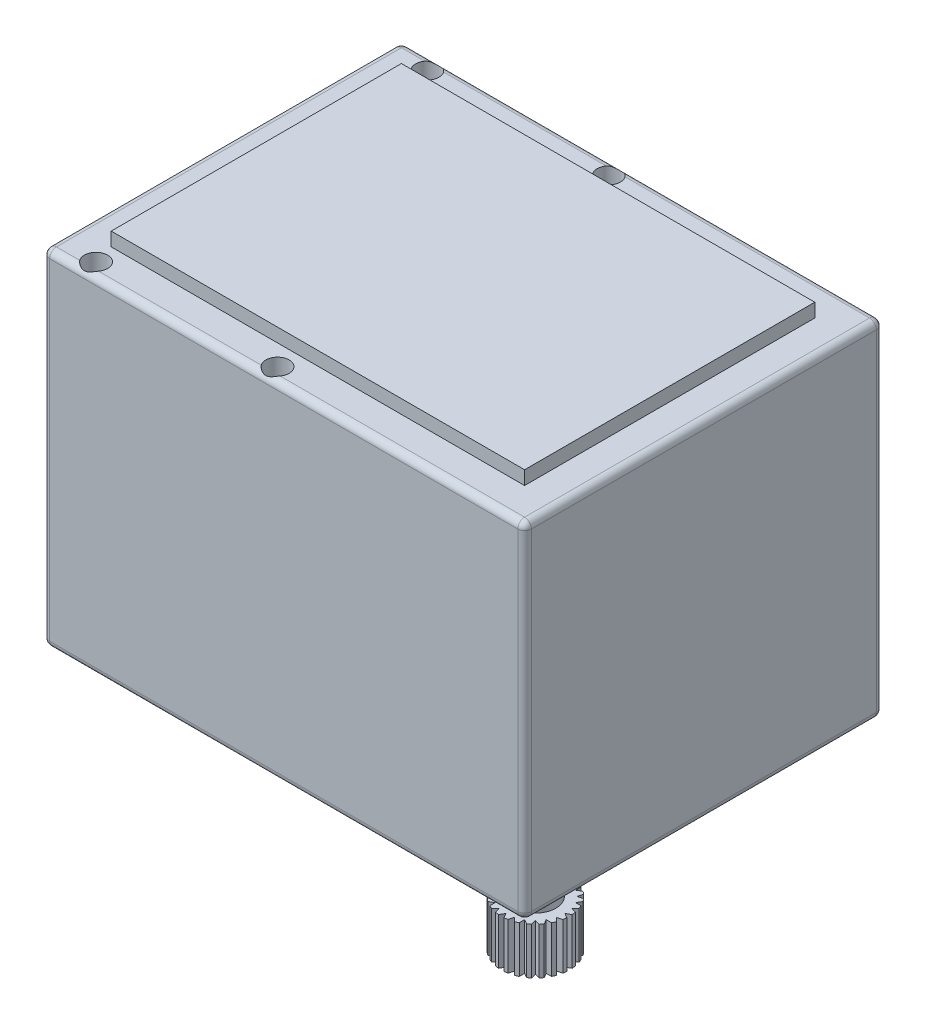
from build123d import *

# Parameters (mm, degrees)
EXTRUDE_START        = -6.25
SKETCH_1_W           = 35.2
SKETCH_1_H           = 25.2
EXTRUDE_1_DEPTH      = 13.1
EXTRUDE_5_DEPTH      = 4.4
SKETCH_16_R          = 1.3
CUT_EXTRUDE_7_DEPTH  = 5.5
FILLET_2_R           = 0.5
SKETCH_17_W          = 30.2
SKETCH_17_H          = 21.2
EXTRUDE_6_DEPTH      = 1
SKETCH_18_W          = 30.2
SKETCH_18_H          = 21.2
EXTRUDE_7_DEPTH      = 1
SKETCH_19_R          = 0.85
CUT_EXTRUDE_8_DEPTH  = 5
CUT_EXTRUDE_START    = -5
SKETCH_21_R          = 0.85
CUT_EXTRUDE_9_DEPTH  = 5
MOVE_FACE_1_BY       = 10
SKETCH_22_R          = 3.658774852
SKETCH_22_R_2        = 1.5
CUT_EXTRUDE_10_DEPTH = 10
EXTRUDE_START_2      = 10
SKETCH_23_R          = 1.3
EXTRUDE_8_DEPTH      = 10


with BuildPart() as part:
    # 草图1 → 凸台-拉伸1 (new, symmetric)
    with BuildSketch(Plane.XY.offset(6.25).offset(EXTRUDE_START)):
        with Locations((0, -0.411180124)):
            Rectangle(SKETCH_1_W, SKETCH_1_H)
    extrude(amount=EXTRUDE_1_DEPTH, both=True)

    # 草图15 → 凸台-拉伸5 (add)
    with BuildSketch(Plane.XZ.offset(13.011180124)):
        with BuildLine():
            Line((3.874456691, -2.060639983), (4.213205081, -1.865063509))
            Line((4.213205081, -1.865063509), (4.213205081, -2.256216457))
            ThreePointArc((4.213205081, -2.256216457), (4.333291419, -2.309698831), (4.456023033, -2.356794946))
            Line((4.456023033, -2.356794946), (4.732609934, -2.080208044))
            Line((4.732609934, -2.080208044), (4.833847767, -2.458032779))
            ThreePointArc((4.833847767, -2.458032779), (4.963684519, -2.478612153), (5.094423526, -2.492338228))
            Line((5.094423526, -2.492338228), (5.29, -2.153589838))
            Line((5.29, -2.153589838), (5.485576474, -2.492338228))
            ThreePointArc((5.485576474, -2.492338228), (5.616315481, -2.478612153), (5.746152233, -2.458032779))
            Line((5.746152233, -2.458032779), (5.847390066, -2.080208044))
            Line((5.847390066, -2.080208044), (6.123976967, -2.356794946))
            ThreePointArc((6.123976967, -2.356794946), (6.246708581, -2.309698831), (6.366794919, -2.256216457))
            Line((6.366794919, -2.256216457), (6.366794919, -1.865063509))
            Line((6.366794919, -1.865063509), (6.705543309, -2.060639983))
            ThreePointArc((6.705543309, -2.060639983), (6.811903573, -1.983383351), (6.914055811, -1.900642713))
            Line((6.914055811, -1.900642713), (6.812817979, -1.522817979))
            Line((6.812817979, -1.522817979), (7.190642713, -1.624055811))
            ThreePointArc((7.190642713, -1.624055811), (7.273383351, -1.521903573), (7.350639983, -1.415543309))
            Line((7.350639983, -1.415543309), (7.155063509, -1.076794919))
            Line((7.155063509, -1.076794919), (7.546216457, -1.076794919))
            ThreePointArc((7.546216457, -1.076794919), (7.599698831, -0.956708581), (7.646794946, -0.833976967))
            Line((7.646794946, -0.833976967), (7.370208044, -0.557390066))
            Line((7.370208044, -0.557390066), (7.748032779, -0.456152233))
            ThreePointArc((7.748032779, -0.456152233), (7.768612153, -0.326315481), (7.782338228, -0.195576474))
            Line((7.782338228, -0.195576474), (7.443589838, 0))
            Line((7.443589838, 0), (7.782338228, 0.195576474))
            ThreePointArc((7.782338228, 0.195576474), (7.768612153, 0.326315481), (7.748032779, 0.456152233))
            Line((7.748032779, 0.456152233), (7.370208044, 0.557390066))
            Line((7.370208044, 0.557390066), (7.646794946, 0.833976967))
            ThreePointArc((7.646794946, 0.833976967), (7.599698831, 0.956708581), (7.546216457, 1.076794919))
            Line((7.546216457, 1.076794919), (7.155063509, 1.076794919))
            Line((7.155063509, 1.076794919), (7.350639983, 1.415543309))
            ThreePointArc((7.350639983, 1.415543309), (7.273383351, 1.521903573), (7.190642713, 1.624055811))
            Line((7.190642713, 1.624055811), (6.812817979, 1.522817979))
            Line((6.812817979, 1.522817979), (6.914055811, 1.900642713))
            ThreePointArc((6.914055811, 1.900642713), (6.811903573, 1.983383351), (6.705543309, 2.060639983))
            Line((6.705543309, 2.060639983), (6.366794919, 1.865063509))
            Line((6.366794919, 1.865063509), (6.366794919, 2.256216457))
            ThreePointArc((6.366794919, 2.256216457), (6.246708581, 2.309698831), (6.123976967, 2.356794946))
            Line((6.123976967, 2.356794946), (5.847390066, 2.080208044))
            Line((5.847390066, 2.080208044), (5.746152233, 2.458032779))
            ThreePointArc((5.746152233, 2.458032779), (5.616315481, 2.478612153), (5.485576474, 2.492338228))
            Line((5.485576474, 2.492338228), (5.29, 2.153589838))
            Line((5.29, 2.153589838), (5.094423526, 2.492338228))
            ThreePointArc((5.094423526, 2.492338228), (4.963684519, 2.478612153), (4.833847767, 2.458032779))
            Line((4.833847767, 2.458032779), (4.732609934, 2.080208044))
            Line((4.732609934, 2.080208044), (4.456023033, 2.356794946))
            ThreePointArc((4.456023033, 2.356794946), (4.333291419, 2.309698831), (4.213205081, 2.256216457))
            Line((4.213205081, 2.256216457), (4.213205081, 1.865063509))
            Line((4.213205081, 1.865063509), (3.874456691, 2.060639983))
            ThreePointArc((3.874456691, 2.060639983), (3.768096427, 1.983383351), (3.665944189, 1.900642713))
            Line((3.665944189, 1.900642713), (3.767182021, 1.522817979))
            Line((3.767182021, 1.522817979), (3.389357287, 1.624055811))
            ThreePointArc((3.389357287, 1.624055811), (3.306616649, 1.521903573), (3.229360017, 1.415543309))
            Line((3.229360017, 1.415543309), (3.424936491, 1.076794919))
            Line((3.424936491, 1.076794919), (3.033783543, 1.076794919))
            ThreePointArc((3.033783543, 1.076794919), (2.980301169, 0.956708581), (2.933205054, 0.833976967))
            Line((2.933205054, 0.833976967), (3.209791956, 0.557390066))
            Line((3.209791956, 0.557390066), (2.831967221, 0.456152233))
            ThreePointArc((2.831967221, 0.456152233), (2.811387847, 0.326315481), (2.797661772, 0.195576474))
            Line((2.797661772, 0.195576474), (3.136410162, 0))
            Line((3.136410162, 0), (2.797661772, -0.195576474))
            ThreePointArc((2.797661772, -0.195576474), (2.811387847, -0.326315481), (2.831967221, -0.456152233))
            Line((2.831967221, -0.456152233), (3.209791956, -0.557390066))
            Line((3.209791956, -0.557390066), (2.933205054, -0.833976967))
            ThreePointArc((2.933205054, -0.833976967), (2.980301169, -0.956708581), (3.033783543, -1.076794919))
            Line((3.033783543, -1.076794919), (3.424936491, -1.076794919))
            Line((3.424936491, -1.076794919), (3.229360017, -1.415543309))
            ThreePointArc((3.229360017, -1.415543309), (3.306616649, -1.521903573), (3.389357287, -1.624055811))
            Line((3.389357287, -1.624055811), (3.767182021, -1.522817979))
            Line((3.767182021, -1.522817979), (3.665944189, -1.900642713))
            ThreePointArc((3.665944189, -1.900642713), (3.768096427, -1.983383351), (3.874456691, -2.060639983))
        make_face()
    extrude(amount=EXTRUDE_5_DEPTH)

    # 草图16 → 切除-拉伸7 (cut)
    with BuildSketch(Plane.XZ.offset(17.411180124)):
        with Locations(Location((5.29, 0, 0), (0, 0, 270))):
            Circle(SKETCH_16_R)
    extrude(amount=-CUT_EXTRUDE_7_DEPTH, mode=Mode.SUBTRACT)

    # 圆角2
    fillet_2_edges = [part.edges().sort_by_distance(p)[0] for p in [
        (0, 12.188819876, -13.1),
        (-17.6, -0.411180124, -13.1),
        (0, -13.011180124, -13.1),
        (-17.6, -0.411180124, 13.1),
        (0, 12.188819876, 13.1),
        (17.6, -0.411180124, 13.1),
        (0, -13.011180124, 13.1),
        (-17.6, -13.011180124, 0),
        (-17.6, 12.188819876, 0),
        (17.6, 12.188819876, 0),
        (17.6, -13.011180124, 0),
        (17.6, -0.411180124, -13.1),
    ]]
    fillet(fillet_2_edges, radius=FILLET_2_R)

    # 草图17 → 凸台-拉伸6 (add)
    with BuildSketch(Plane.XZ.offset(13.011180124)):
        Rectangle(SKETCH_17_W, SKETCH_17_H)
    extrude(amount=EXTRUDE_6_DEPTH)

    # 草图18 → 凸台-拉伸7 (add)
    with BuildSketch(Plane(origin=(0, 12.188819876, 0), x_dir=(1, 0, 0), z_dir=(0, 1, 0))):
        Rectangle(SKETCH_18_W, SKETCH_18_H)
    extrude(amount=EXTRUDE_7_DEPTH)

    # 草图19 → 切除-拉伸8 (cut)
    with BuildSketch(Plane.XZ.offset(13.011180124)):
        with Locations(Location((-1.45, 12.1, 0), (0, 0, 270))):
            Circle(SKETCH_19_R)
        with Locations(Location((-14.71, 12.1, 0), (0, 0, 270))):
            Circle(SKETCH_19_R)
        with Locations(Location((-1.45, -12.1, 0), (0, 0, 270))):
            Circle(SKETCH_19_R)
        with Locations(Location((-14.71, -12.1, 0), (0, 0, 270))):
            Circle(SKETCH_19_R)
    extrude(amount=-CUT_EXTRUDE_8_DEPTH, mode=Mode.SUBTRACT)

    # 草图21 → 切除-拉伸9 (cut)
    with BuildSketch(Plane(origin=(0, 12.188819876, 0), x_dir=(1, 0, 0), z_dir=(0, 1, 0)).offset(CUT_EXTRUDE_START)):
        with Locations(Location((-14.71, 12.1, 0), (0, 0, 90))):
            Circle(SKETCH_21_R)
        with Locations(Location((-1.45, 12.1, 0), (0, 0, 90))):
            Circle(SKETCH_21_R)
        with Locations(Location((-1.45, -12.1, 0), (0, 0, 90))):
            Circle(SKETCH_21_R)
        with Locations(Location((-14.71, -12.1, 0), (0, 0, 90))):
            Circle(SKETCH_21_R)
    extrude(amount=CUT_EXTRUDE_9_DEPTH, mode=Mode.SUBTRACT)

    # Move Face 1: a face moved outward by 10.0
    extrude(part.faces().sort_by_distance((5.29, -17.411180124, -1.993870582))[0], amount=MOVE_FACE_1_BY, dir=(0, -1, 0))

    # 草图22 → 切除-拉伸10 (cut)
    with BuildSketch(Plane.XZ.offset(14.011180124)):
        with Locations((5.29, 0)):
            Circle(SKETCH_22_R)
        with Locations(Location((5.29, 0, 0), (0, 0, 270))):
            Circle(SKETCH_22_R_2, mode=Mode.SUBTRACT)
    extrude(amount=CUT_EXTRUDE_10_DEPTH, mode=Mode.SUBTRACT)

    # 草图23 → 凸台-拉伸8 (add)
    with BuildSketch(Plane.XZ.offset(14.011180124).offset(EXTRUDE_START_2)):
        with Locations(Location((5.29, 0, 0), (0, 0, 270))):
            Circle(SKETCH_23_R)
    extrude(amount=-EXTRUDE_8_DEPTH)


solid = part.part
